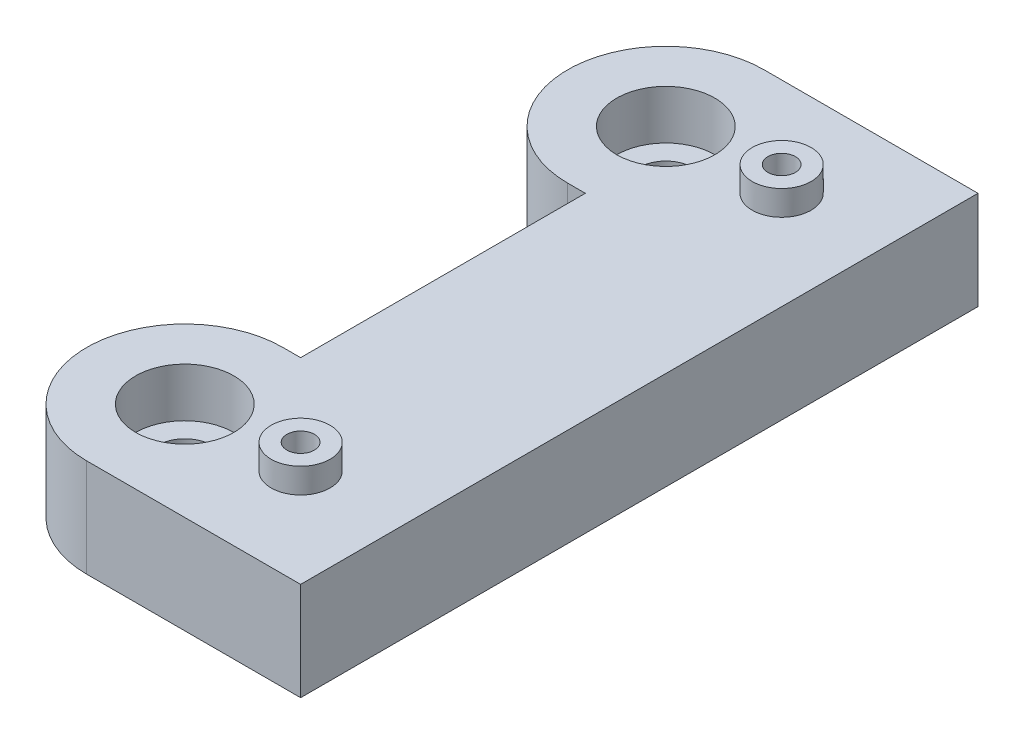
from build123d import *

# Parameters (mm, degrees)
SKETCH2_R                      = 1.4
BOSS_EXTRUDE1_DEPTH            = 10
SKETCH3_R                      = 3
SKETCH3_R_2                    = 1.4
BOSS_EXTRUDE2_DEPTH            = 2.54
CBORE_FOR_M5_SHCS1_D           = 5.5
CBORE_FOR_M5_SHCS1_DEPTH       = 12
CBORE_FOR_M5_SHCS1_CBORE_D     = 10
CBORE_FOR_M5_SHCS1_CBORE_DEPTH = 5
CBORE_FOR_M5_SHCS1_TIP         = 1.652366702


with BuildPart() as part:
    # Sketch2 → Boss-Extrude1 (new body)
    with BuildSketch(Plane(origin=(0, 0, 0), x_dir=(1, 0, 0), z_dir=(0, 1, 0))):
        with BuildLine():
            Line((-40.8, 14.5), (-39, 14.5))
            Line((-39, 14.5), (-39, -14.5))
            Line((-39, -14.5), (-40.8, -14.5))
            ThreePointArc((-40.8, -14.5), (-50.8, -24.5), (-40.8, -34.5))
            Line((-40.8, -34.5), (-19, -34.5))
            Line((-19, -34.5), (-19, 34.5))
            Line((-19, 34.5), (-40.8, 34.5))
            ThreePointArc((-40.8, 34.5), (-50.8, 24.5), (-40.8, 14.5))
        make_face()
        with Locations(Location((-29, -24.5, 0), (0, 0, 270))):
            Circle(SKETCH2_R, mode=Mode.SUBTRACT)
        with Locations(Location((-29, 24.5, 0), (0, 0, 270))):
            Circle(SKETCH2_R, mode=Mode.SUBTRACT)
    extrude(amount=BOSS_EXTRUDE1_DEPTH)

    # Sketch3 → Boss-Extrude2 (add)
    # profile 1 of 2: a face of its own
    with BuildSketch(Plane(origin=(0, 10, 0), x_dir=(1, 0, 0), z_dir=(0, 1, 0))):
        with Locations(Location((-29, 24.5, 0), (0, 0, 90))):
            Circle(SKETCH3_R)
        with Locations(Location((-29, 24.5, 0), (0, 0, 270))):
            Circle(SKETCH3_R_2, mode=Mode.SUBTRACT)
    # profile 2 of 2: a face of its own
    with BuildSketch(Plane(origin=(0, 10, 0), x_dir=(1, 0, 0), z_dir=(0, 1, 0))):
        with Locations(Location((-29, -24.5, 0), (0, 0, 90))):
            Circle(SKETCH3_R)
        with Locations(Location((-29, -24.5, 0), (0, 0, 270))):
            Circle(SKETCH3_R_2, mode=Mode.SUBTRACT)
    extrude(amount=BOSS_EXTRUDE2_DEPTH)

    # CBORE for M5 SHCS1
    with Locations(Plane(origin=(0, 10, 0), x_dir=(1, 0, 0), z_dir=(0, 1, 0))):
        with Locations((-40.8, -24.5), (-40.8, 24.5)):
            CounterBoreHole(CBORE_FOR_M5_SHCS1_D / 2, CBORE_FOR_M5_SHCS1_CBORE_D / 2, CBORE_FOR_M5_SHCS1_CBORE_DEPTH, depth=CBORE_FOR_M5_SHCS1_DEPTH)
            with Locations((0, 0, -(CBORE_FOR_M5_SHCS1_DEPTH + CBORE_FOR_M5_SHCS1_TIP / 2))):  # 118° drill point
                Cone(0, CBORE_FOR_M5_SHCS1_D / 2, CBORE_FOR_M5_SHCS1_TIP, mode=Mode.SUBTRACT)


solid = part.part
